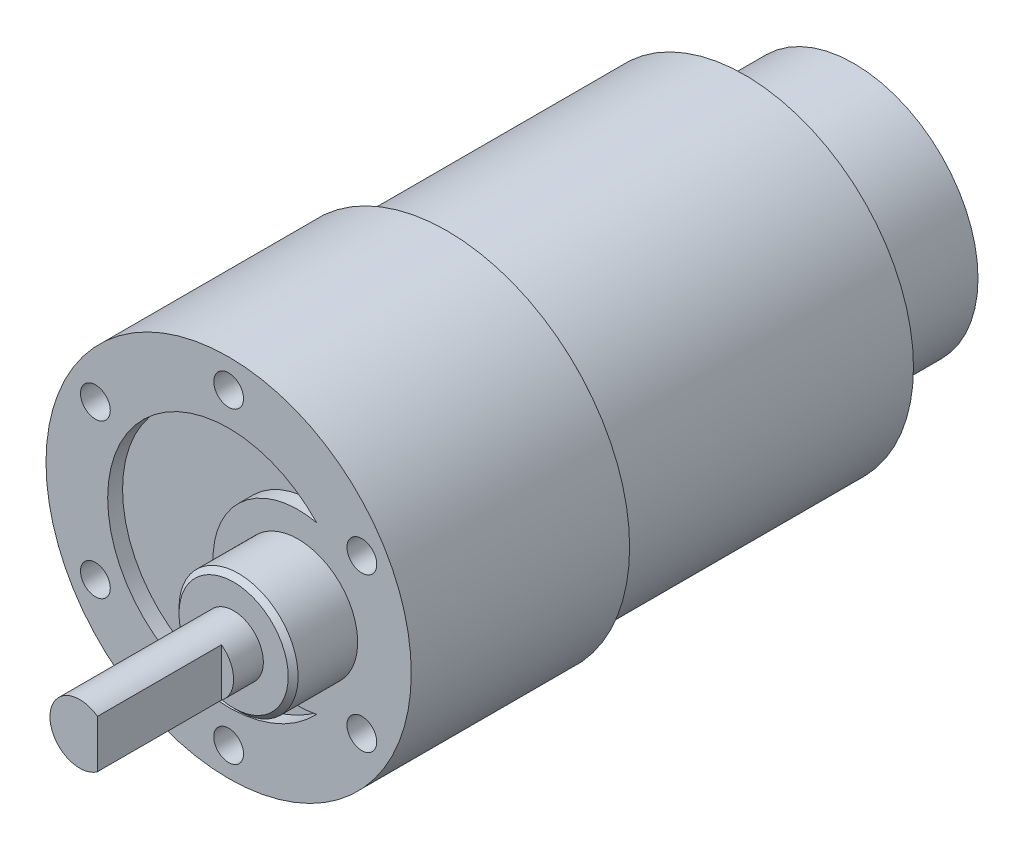
from build123d import *

# Parameters (mm, degrees)
SKETCH1_R           = 17
BOSS_EXTRUDE1_DEPTH = 30
FILLET1_R           = 1
SKETCH2_R           = 18.4
BOSS_EXTRUDE2_DEPTH = 22
SKETCH3_R           = 1.5
CUT_EXTRUDE1_DEPTH  = 3
SKETCH4_R           = 6
BOSS_EXTRUDE3_DEPTH = 6.5
CHAMFER1_SIZE       = 0.5
SKETCH5_R           = 3
BOSS_EXTRUDE4_DEPTH = 15.5
CUT_EXTRUDE3_DEPTH  = 1.5
SKETCH7_R           = 12.5
BOSS_EXTRUDE5_DEPTH = 11
CUT_EXTRUDE4_START  = -12.5
CUT_EXTRUDE4_DEPTH  = 12.5


with BuildPart() as part:
    # Sketch1 → Boss-Extrude1 (new body)
    with BuildSketch(Plane.XY):
        Circle(SKETCH1_R)
    extrude(amount=BOSS_EXTRUDE1_DEPTH)

    # Fillet1
    fillet1_edges = [part.edges().sort_by_distance(p)[0] for p in [
        (-17, 0, 30),
    ]]
    fillet(fillet1_edges, radius=FILLET1_R)

    # Sketch2 → Boss-Extrude2 (add)
    with BuildSketch(Plane.XY.offset(30)):
        Circle(SKETCH2_R)
    extrude(amount=BOSS_EXTRUDE2_DEPTH)

    # Sketch3 → Cut-Extrude1 (cut)
    with BuildSketch(Plane.XY.offset(52)):
        with Locations((0, 15.5)):
            Circle(SKETCH3_R)
        with Locations((13.423393759, 7.75)):
            Circle(SKETCH3_R)
        with Locations((13.423393759, -7.75)):
            Circle(SKETCH3_R)
        with Locations((0, -15.5)):
            Circle(SKETCH3_R)
        with Locations((-13.423393759, -7.75)):
            Circle(SKETCH3_R)
        with Locations((-13.423393759, 7.75)):
            Circle(SKETCH3_R)
    extrude(amount=-CUT_EXTRUDE1_DEPTH, mode=Mode.SUBTRACT)

    # Sketch4 → Boss-Extrude3 (add)
    with BuildSketch(Plane.XY.offset(52)):
        with Locations(Location((7, 0, 0), (0, 0, 180))):
            Circle(SKETCH4_R)
    extrude(amount=BOSS_EXTRUDE3_DEPTH)

    # Chamfer1
    chamfer1_edges = [part.edges().sort_by_distance(p)[0] for p in [
        (13, 0, 58.5),
    ]]
    chamfer(chamfer1_edges, length=CHAMFER1_SIZE)

    # Sketch5 → Boss-Extrude4 (add)
    with BuildSketch(Plane.XY.offset(58.5)):
        with Locations((7, 0)):
            Circle(SKETCH5_R)
    extrude(amount=BOSS_EXTRUDE4_DEPTH)

    # Sketch6 → Cut-Extrude3 (cut)
    with BuildSketch(Plane.XY.offset(52)):
        with BuildLine():
            ThreePointArc((8.868134735, -8.359715213), (-1.565907181, 0), (8.868134735, 8.359715213))
            ThreePointArc((8.868134735, 8.359715213), (-12.187233161, 0), (8.868134735, -8.359715213))
        make_face()
    extrude(amount=-CUT_EXTRUDE3_DEPTH, mode=Mode.SUBTRACT)

    # Sketch7 → Boss-Extrude5 (add)
    with BuildSketch(Plane(origin=(0, 0, 0), x_dir=(-1, 0, 0), z_dir=(0, 0, -1))):
        with Locations(Location((0, 0, 0), (0, 0, 180))):
            Circle(SKETCH7_R)
    extrude(amount=BOSS_EXTRUDE5_DEPTH)

    # Sketch8 → Cut-Extrude4 (cut)
    with BuildSketch(Plane.XY.offset(74).offset(CUT_EXTRUDE4_START)):
        with BuildLine():
            Line((8.779351905, 2.415348174), (8.779351905, -2.415348174))
            ThreePointArc((8.779351905, -2.415348174), (10, 0), (8.779351905, 2.415348174))
        make_face()
    extrude(amount=CUT_EXTRUDE4_DEPTH, mode=Mode.SUBTRACT)


solid = part.part
